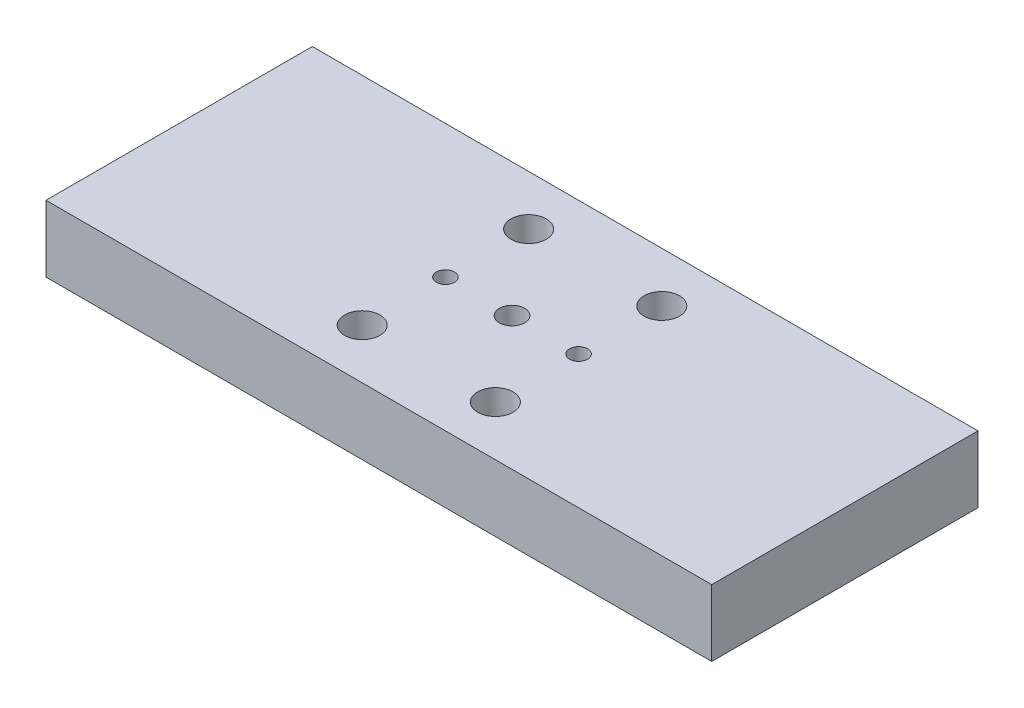
from build123d import *

# Parameters (mm, degrees)
SKETCH1_W                 = 127
SKETCH1_H                 = 50.8
BOSS_EXTRUDE1_DEPTH       = 12.7
SKETCH2_R                 = 2.413
CUT_EXTRUDE1_DEPTH        = 70.560764803
F_1_4_CLEARANCE_HOLE1_D   = 6.7564
TAP_DRILL_FOR_8_32_TAP1_D = 3.4544


with BuildPart() as part:
    # Sketch1 → Boss-Extrude1 (new body)
    with BuildSketch(Plane(origin=(0, 0, 0), x_dir=(1, 0, 0), z_dir=(0, 1, 0))):
        Rectangle(SKETCH1_W, SKETCH1_H)
    extrude(amount=BOSS_EXTRUDE1_DEPTH)

    # Sketch2 → Cut-Extrude1 (cut, through all)
    with BuildSketch(Plane(origin=(0, 12.7, 0), x_dir=(1, 0, 0), z_dir=(0, 1, 0))):
        with Locations(Location((0, 0, 0), (0, 0, 270))):
            Circle(SKETCH2_R)
    extrude(amount=-CUT_EXTRUDE1_DEPTH, mode=Mode.SUBTRACT)

    # 1/4 Clearance Hole1 (through all)
    with Locations(Plane(origin=(0, 12.7, 0), x_dir=(1, 0, 0), z_dir=(0, 1, 0))):
        with Locations((-12.7, 15.875), (12.7, 15.875), (-12.7, -15.875), (12.7, -15.875)):
            Hole(F_1_4_CLEARANCE_HOLE1_D / 2)

    # Tap Drill for #8-32 Tap1 (through all)
    with Locations(Plane(origin=(0, 12.7, 0), x_dir=(1, 0, 0), z_dir=(0, 1, 0))):
        with Locations((12.7, 0), (-12.7, 0)):
            Hole(TAP_DRILL_FOR_8_32_TAP1_D / 2)


solid = part.part
